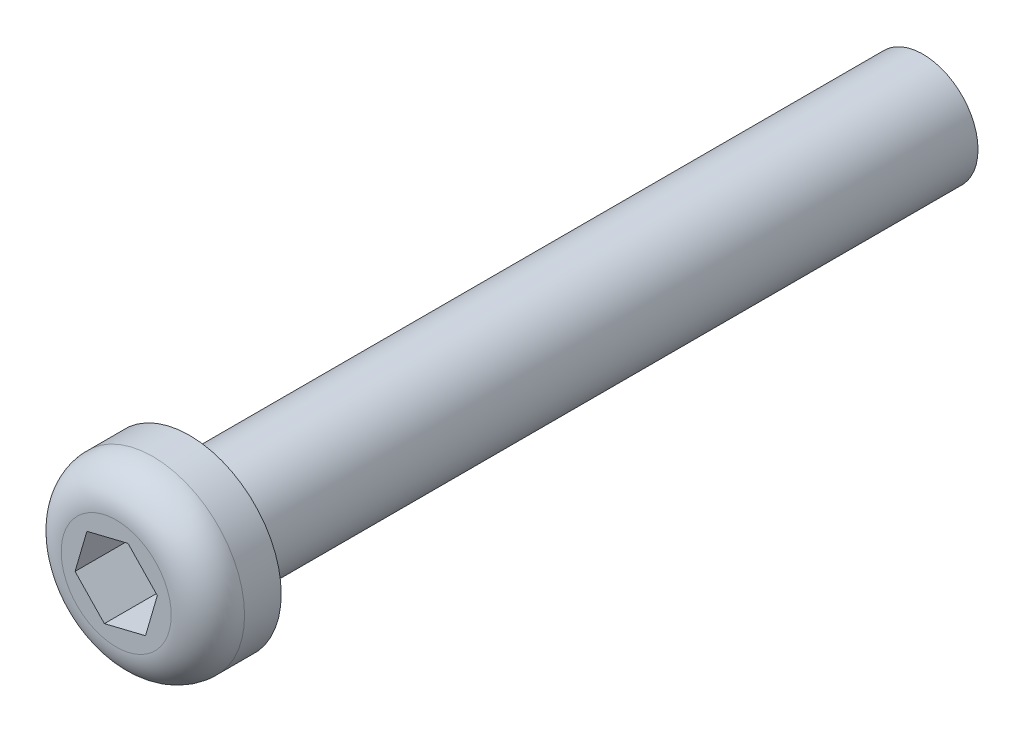
from build123d import *

# Parameters (mm, degrees)
SKETCH_1_R          = 1.5
EXTRUDE_1_DEPTH     = 20
SKETCH_2_R          = 2.5
EXTRUDE_2_DEPTH     = 2
CUT_EXTRUDE_1_DEPTH = 1.5
FILLET_1_R          = 1


with BuildPart() as part:
    # 草图1 → 凸台-拉伸1 (new body)
    with BuildSketch(Plane.XY):
        Circle(SKETCH_1_R)
    extrude(amount=EXTRUDE_1_DEPTH)

    # 草图2 → 凸台-拉伸2 (add)
    with BuildSketch(Plane.XY.offset(20)):
        Circle(SKETCH_2_R)
    extrude(amount=EXTRUDE_2_DEPTH)

    # 草图3 → 切除-拉伸1 (cut)
    with BuildSketch(Plane.XY.offset(22)):
        Polygon((0.32253882, 1.108738943), (-0.798926681, 0.833696283), (-1.1214655, -0.27504266), (-0.32253882, -1.108738943), (0.798926681, -0.833696283), (1.1214655, 0.27504266), align=None)
    extrude(amount=-CUT_EXTRUDE_1_DEPTH, mode=Mode.SUBTRACT)

    # 圆角1
    fillet_1_edges = [part.edges().sort_by_distance(p)[0] for p in [
        (-2.5, 0, 22),
    ]]
    fillet(fillet_1_edges, radius=FILLET_1_R)


solid = part.part
